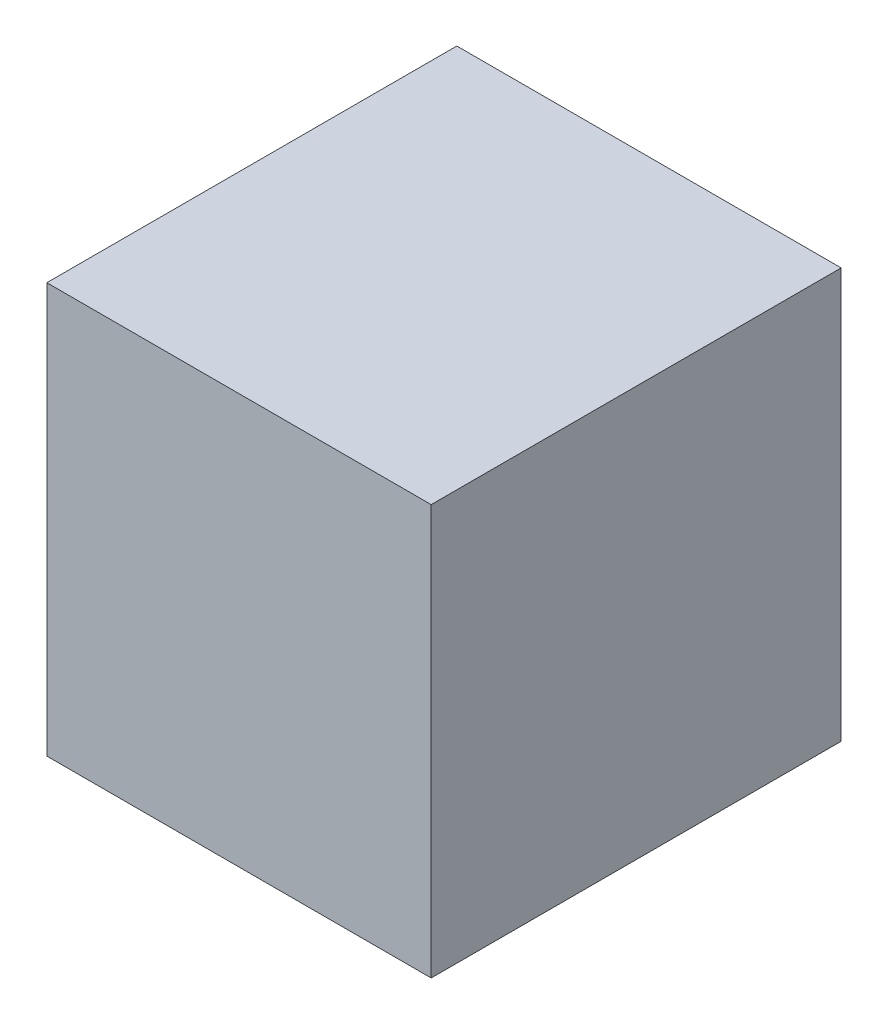
from build123d import *

# Parameters (mm, degrees)
MTG_M12_SOKET_1_START = 8
SKETCH1_W             = 15
SKETCH1_H             = 16
MTG_M12_SOKET_1_DEPTH = 16


with BuildPart() as part:
    # Sketch1 → MTG_M12_soket_1 (new body)
    with BuildSketch(Plane.XY.offset(MTG_M12_SOKET_1_START)):
        with Locations((150.5, 0)):
            Rectangle(SKETCH1_W, SKETCH1_H)
    extrude(amount=-MTG_M12_SOKET_1_DEPTH)


solid = part.part
